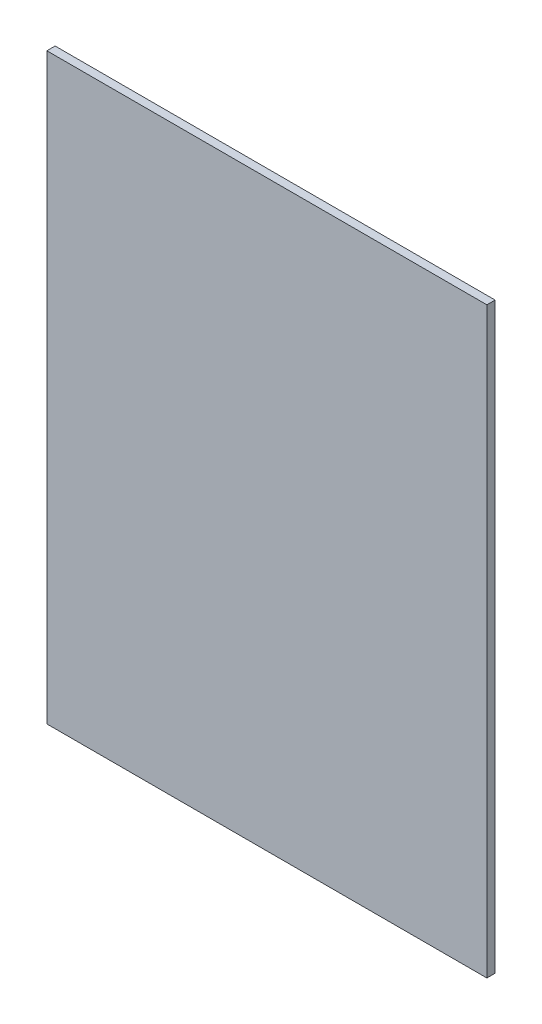
from build123d import *

# Parameters (mm, degrees)
SKETCH1_W           = 160
SKETCH1_H           = 212
BOSS_EXTRUDE1_DEPTH = 1.5


with BuildPart() as part:
    # Sketch1 → Boss-Extrude1 (new, symmetric)
    with BuildSketch(Plane.XY):
        Rectangle(SKETCH1_W, SKETCH1_H)
    extrude(amount=BOSS_EXTRUDE1_DEPTH, both=True)


solid = part.part
